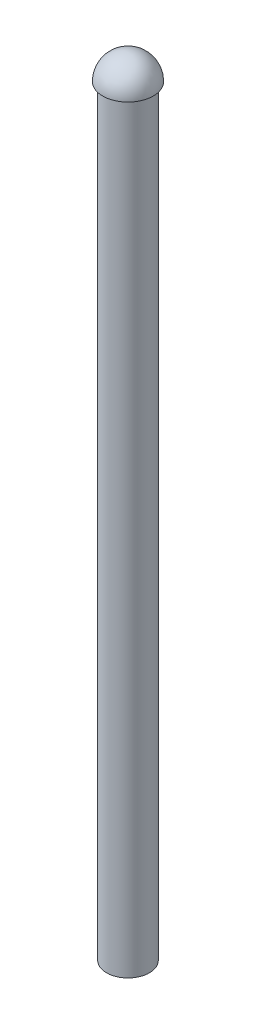
from build123d import *

# Parameters (mm, degrees)
SKETCH1_R           = 0.714375
BOSS_EXTRUDE1_DEPTH = 25.4
REVOLVE1_ANGLE      = 180


with BuildPart() as part:
    # Sketch1 → Boss-Extrude1 (new body)
    with BuildSketch(Plane(origin=(0, 0, 0), x_dir=(1, 0, 0), z_dir=(0, 1, 0))):
        with Locations(Location((0, 0, 0), (0, 0, 270))):
            Circle(SKETCH1_R)
    extrude(amount=BOSS_EXTRUDE1_DEPTH)

    # Sketch2 → Revolve1 (revolve)
    with BuildSketch(Plane(origin=(0, 25.4, 0), x_dir=(1, 0, 0), z_dir=(0, 1, 0))):
        with BuildLine():
            Line((-0.016244213, 0.841218174), (0.016244213, -0.841218174))
            ThreePointArc((0.016244213, -0.841218174), (-0.841218174, -0.016244213), (-0.016244213, 0.841218174))
        make_face()
    revolve(axis=Axis((-0.016244213, 25.4, -0.841218174), (-0.019306745522544785, 0, -0.9998136074175665)), revolution_arc=REVOLVE1_ANGLE)


solid = part.part
